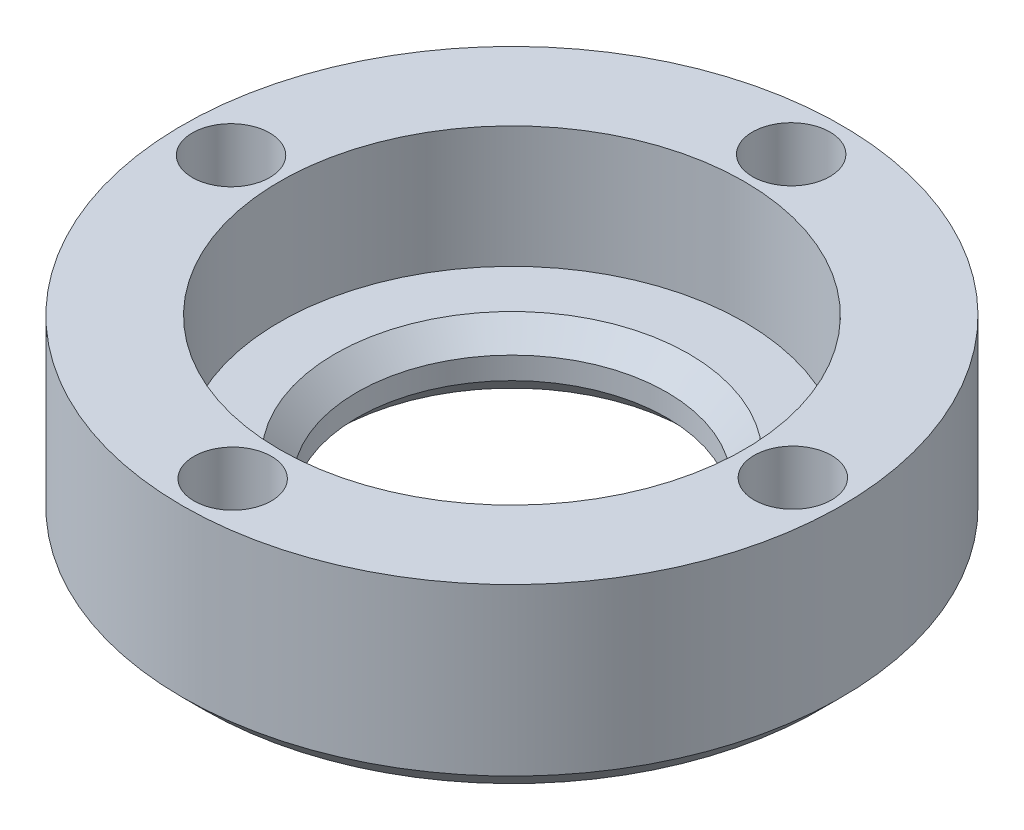
from build123d import *

# Parameters (mm, degrees)
SKETCH1_R           = 14.9
BOSS_EXTRUDE1_DEPTH = 3
SKETCH2_R           = 7
CUT_EXTRUDE1_DEPTH  = 22.28426649
SKETCH3_R           = 14.9
SKETCH3_R_2         = 10.5
BOSS_EXTRUDE2_DEPTH = 3.5
CHAMFER1_SIZE       = 1
SKETCH4_R           = 1.75
CUT_EXTRUDE2_DEPTH  = 4
BOSS_EXTRUDE3_START = 2
SKETCH5_R           = 14.9
SKETCH5_R_2         = 10.5
SKETCH5_R_3         = 1.75
BOSS_EXTRUDE3_DEPTH = 2


with BuildPart() as part:
    # Sketch1 → Boss-Extrude1 (new body)
    with BuildSketch(Plane(origin=(0, 0, 0), x_dir=(-1, 0, 0), z_dir=(0, 1, 0))):
        with Locations(Location((0, 0, 0), (0, 0, 90))):
            Circle(SKETCH1_R)
    extrude(amount=BOSS_EXTRUDE1_DEPTH)

    # Sketch2 → Cut-Extrude1 (cut, through all)
    with BuildSketch(Plane(origin=(0, 3, 0), x_dir=(-1, 0, 0), z_dir=(0, 1, 0))):
        with Locations(Location((0, 0, 0), (0, 0, 90))):
            Circle(SKETCH2_R)
    extrude(amount=-CUT_EXTRUDE1_DEPTH, mode=Mode.SUBTRACT)

    # Sketch3 → Boss-Extrude2 (add)
    with BuildSketch(Plane(origin=(0, 3, 0), x_dir=(-1, 0, 0), z_dir=(0, 1, 0))):
        with Locations(Location((0, 0, 0), (0, 0, 90))):
            Circle(SKETCH3_R)
        with Locations(Location((0, 0, 0), (0, 0, 90))):
            Circle(SKETCH3_R_2, mode=Mode.SUBTRACT)
    extrude(amount=BOSS_EXTRUDE2_DEPTH)

    # Chamfer1
    chamfer1_edges = [part.edges().sort_by_distance(p)[0] for p in [
        (0, 0, -14.9),
        (0, 0, -7),
        (0, 3, -7),
    ]]
    chamfer(chamfer1_edges, length=CHAMFER1_SIZE)

    # Sketch4 → Cut-Extrude2 (cut)
    with BuildSketch(Plane(origin=(0, 6.5, 0), x_dir=(-1, 0, 0), z_dir=(0, 1, 0))):
        with Locations(Location((-12.7, 0, 0), (0, 0, 90))):
            Circle(SKETCH4_R)
        with Locations(Location((-0.075, 12.7, 0), (0, 0, 90))):
            Circle(SKETCH4_R)
        with Locations(Location((12.625, 0.075, 0), (0, 0, 90))):
            Circle(SKETCH4_R)
        with Locations(Location((0, -12.625, 0), (0, 0, 90))):
            Circle(SKETCH4_R)
    extrude(amount=-CUT_EXTRUDE2_DEPTH, mode=Mode.SUBTRACT)

    # Sketch5 → Boss-Extrude3 (add)
    with BuildSketch(Plane(origin=(0, 6.5, 0), x_dir=(-1, 0, 0), z_dir=(0, 1, 0)).offset(BOSS_EXTRUDE3_START)):
        with Locations(Location((0, 0, 0), (0, 0, 90))):
            Circle(SKETCH5_R)
        with Locations(Location((0, 0, 0), (0, 0, 90))):
            Circle(SKETCH5_R_2, mode=Mode.SUBTRACT)
        with Locations(Location((0, -12.625, 0), (0, 0, 90))):
            Circle(SKETCH5_R_3, mode=Mode.SUBTRACT)
        with Locations(Location((12.625, 0.075, 0), (0, 0, 90))):
            Circle(SKETCH5_R_3, mode=Mode.SUBTRACT)
        with Locations(Location((-0.075, 12.7, 0), (0, 0, 90))):
            Circle(SKETCH5_R_3, mode=Mode.SUBTRACT)
        with Locations(Location((-12.7, 0, 0), (0, 0, 90))):
            Circle(SKETCH5_R_3, mode=Mode.SUBTRACT)
    extrude(amount=-BOSS_EXTRUDE3_DEPTH)


solid = part.part
